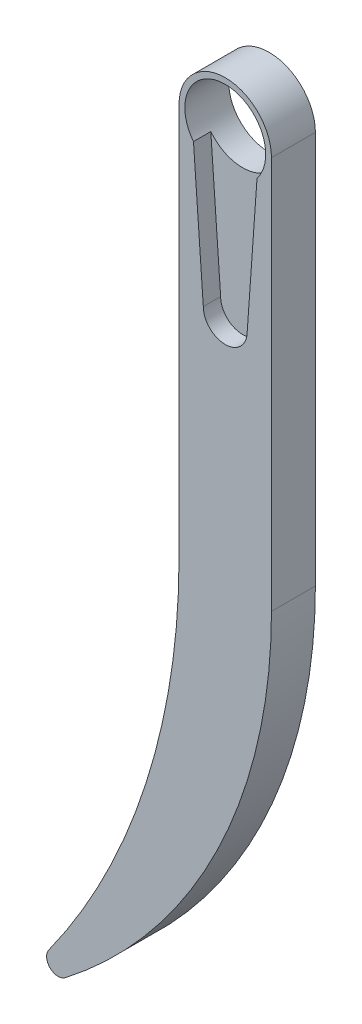
from build123d import *

# Parameters (mm, degrees)
SCHIZZO1_R                   = 1.897864919
ESTRUSIONE_ESTRUSIONE1_DEPTH = 3.8
SCHIZZO7_W                   = 8
SCHIZZO7_H                   = 50
TAGLIO_ESTRUSIONE4_DEPTH     = 3.8
ESTRUSIONE_ESTRUSIONE4_DEPTH = 3.8
RACCORDO2_R                  = 1
SCHIZZO10_R                  = 3.5
TAGLIO_ESTRUSIONE5_DEPTH     = 10
TAGLIO_ESTRUSIONE6_DEPTH     = 1.5


with BuildPart() as part:
    # Schizzo1 → Estrusione-Estrusione1 (new body)
    with BuildSketch(Plane.XY):
        with BuildLine():
            Line((-4, 0), (-4, 80))
            ThreePointArc((-4, 80), (0, 84), (4, 80))
            Line((4, 80), (4, 0))
            ThreePointArc((4, 0), (0, -4), (-4, 0))
        make_face()
        with Locations(Location((0, 80, 0), (0, 0, 180))):
            Circle(SCHIZZO1_R, mode=Mode.SUBTRACT)
    extrude(amount=ESTRUSIONE_ESTRUSIONE1_DEPTH)

    # Schizzo7 → Taglio-Estrusione4 (cut)
    with BuildSketch(Plane.XY.offset(3.8)):
        with Locations((0, 21)):
            Rectangle(SCHIZZO7_W, SCHIZZO7_H)
    extrude(amount=-TAGLIO_ESTRUSIONE4_DEPTH, mode=Mode.SUBTRACT)

    # Schizzo9 → Estrusione-Estrusione4 (add)
    with BuildSketch(Plane.XY.offset(3.8)):
        with BuildLine():
            Line((-4, 46), (4, 46))
            ThreePointArc((4, 46), (-2.243289818, 22.859693708), (-19.27864045, 6))
            ThreePointArc((-19.27864045, 6), (-7.949658462, 24.590674614), (-4, 46))
        make_face()
    extrude(amount=-ESTRUSIONE_ESTRUSIONE4_DEPTH)

    # Raccordo2
    raccordo2_edges = [part.edges().sort_by_distance(p)[0] for p in [
        (-19.27864045, 6, 1.9),
    ]]
    fillet(raccordo2_edges, radius=RACCORDO2_R)

    # Schizzo10 → Taglio-Estrusione5 (cut)
    with BuildSketch(Plane.XY.offset(3.8)):
        with Locations((0, 80)):
            Circle(SCHIZZO10_R)
    extrude(amount=-TAGLIO_ESTRUSIONE5_DEPTH, mode=Mode.SUBTRACT)

    # Schizzo13 → Taglio-Estrusione6 (cut)
    with BuildSketch(Plane.XY.offset(3.8)):
        with BuildLine():
            Line((-2.75, 77.834936491), (-1.9, 65.9))
            ThreePointArc((-1.9, 65.9), (0, 64), (1.9, 65.9))
            Line((1.9, 65.9), (2.75, 77.834936491))
            ThreePointArc((2.75, 77.834936491), (1.145643924, 83.307189139), (-3.5, 80))
            ThreePointArc((-3.5, 80), (-3.307189139, 78.854356076), (-2.75, 77.834936491))
        make_face()
    extrude(amount=-TAGLIO_ESTRUSIONE6_DEPTH, mode=Mode.SUBTRACT)


solid = part.part
